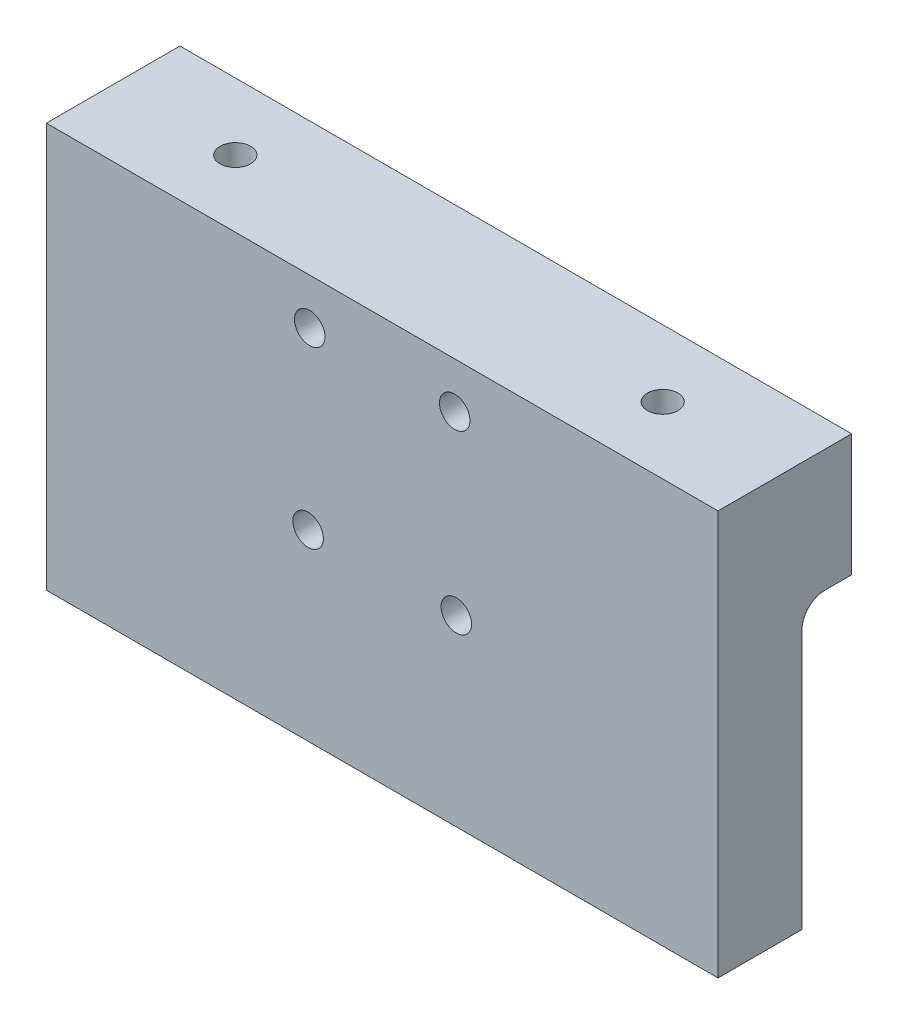
from build123d import *

# Parameters (mm, degrees)
BOSS_EXTRUDE1_DEPTH = 176
SKETCH2_R           = 4
CUT_EXTRUDE1_DEPTH  = 90
SKETCH3_R           = 4
CUT_EXTRUDE2_DEPTH  = 12


with BuildPart() as part:
    # Sketch1 → Boss-Extrude1 (new body)
    with BuildSketch(Plane(origin=(0, 0, 0), x_dir=(0, 0, -1), z_dir=(1, 0, 0))):
        with BuildLine():
            Line((11, 53), (-11, 53))
            Line((-11, 53), (-11, -53))
            Line((-11, -53), (11, -53))
            Line((11, -53), (11, 15))
            ThreePointArc((11, 15), (12.757359313, 19.242640687), (17, 21))
            Line((17, 21), (24, 21))
            Line((24, 21), (24, 53))
            Line((24, 53), (11, 53))
        make_face()
    extrude(amount=BOSS_EXTRUDE1_DEPTH)

    # Sketch2 → Cut-Extrude1 (cut, symmetric)
    with BuildSketch(Plane(origin=(0, 0, -11), x_dir=(-1, 0, 0), z_dir=(0, 0, -1))):
        with Locations(Location((-69, 41, 0), (0, 0, 90))):
            Circle(SKETCH2_R)
        with Locations(Location((-107, 41, 0), (0, 0, 90))):
            Circle(SKETCH2_R)
        with Locations(Location((-68.580611035, -5, 0), (0, 0, 90))):
            Circle(SKETCH2_R)
        with Locations(Location((-107.419388965, -5, 0), (0, 0, 90))):
            Circle(SKETCH2_R)
    extrude(amount=CUT_EXTRUDE1_DEPTH, both=True, mode=Mode.SUBTRACT)

    # Sketch3 → Cut-Extrude2 (cut)
    with BuildSketch(Plane(origin=(0, 53, 0), x_dir=(1, 0, 0), z_dir=(0, 1, 0))):
        with Locations(Location((32, 6.5, 0), (0, 0, 270))):
            Circle(SKETCH3_R)
        with Locations(Location((144, 6.5, 0), (0, 0, 90))):
            Circle(SKETCH3_R)
    extrude(amount=-CUT_EXTRUDE2_DEPTH, mode=Mode.SUBTRACT)


solid = part.part
